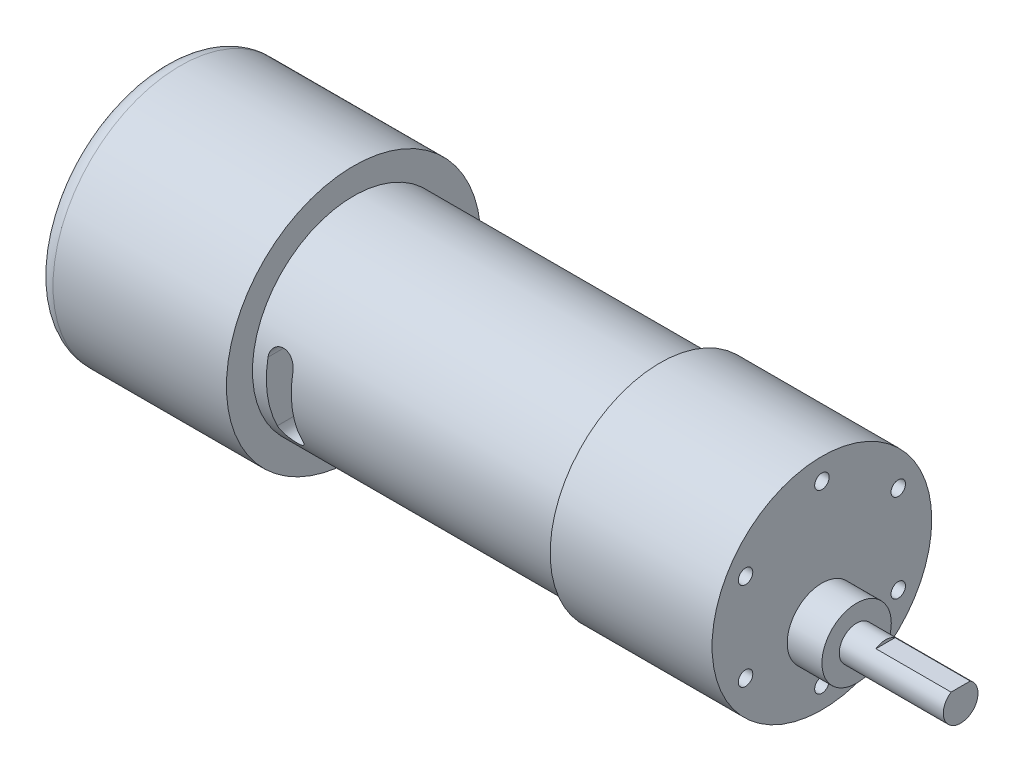
from build123d import *

# Parameters (mm, degrees)
SKETCH1_R           = 22
BOSS_EXTRUDE1_DEPTH = 33
SKETCH2_R           = 17.5
BOSS_EXTRUDE2_DEPTH = 53
SKETCH4_R           = 19
BOSS_EXTRUDE3_DEPTH = 28
CUT_EXTRUDE1_DEPTH  = 119.169369974
SKETCH13_R          = 1.25
CUT_EXTRUDE2_DEPTH  = 3.5
SKETCH15_R          = 6
BOSS_EXTRUDE4_DEPTH = 6
SKETCH16_R          = 3
BOSS_EXTRUDE5_DEPTH = 24
CUT_EXTRUDE3_DEPTH  = 13
FILLET1_R           = 3
SKETCH18_R          = 1
BOSS_EXTRUDE6_DEPTH = 5


with BuildPart() as part:
    # Sketch1 → Boss-Extrude1 (new body)
    with BuildSketch(Plane(origin=(0, 0, 0), x_dir=(0, 0, -1), z_dir=(1, 0, 0))):
        Circle(SKETCH1_R)
    extrude(amount=BOSS_EXTRUDE1_DEPTH)

    # Sketch2 → Boss-Extrude2 (add)
    with BuildSketch(Plane(origin=(33, 0, 0), x_dir=(0, 0, -1), z_dir=(1, 0, 0))):
        Circle(SKETCH2_R)
    extrude(amount=BOSS_EXTRUDE2_DEPTH)

    # Sketch4 → Boss-Extrude3 (add)
    with BuildSketch(Plane(origin=(86, 0, 0), x_dir=(0, 0, -1), z_dir=(1, 0, 0))):
        Circle(SKETCH4_R)
    extrude(amount=BOSS_EXTRUDE3_DEPTH)

    # Sketch12 → Cut-Extrude1 (cut, through all)
    with BuildSketch(Plane.XY):
        with BuildLine():
            Line((39.717889668, 3.156796221), (39.717889668, -7.930488068))
            ThreePointArc((39.717889668, -7.930488068), (37.562028834, -10.086348902), (35.406168, -7.930488068))
            Line((35.406168, -7.930488068), (35.406168, 3.156796221))
            ThreePointArc((35.406168, 3.156796221), (37.562028834, 5.312657055), (39.717889668, 3.156796221))
        make_face()
    extrude(amount=CUT_EXTRUDE1_DEPTH, mode=Mode.SUBTRACT)

    # Sketch13 → Cut-Extrude2 (cut)
    with BuildSketch(Plane(origin=(114, 0, 0), x_dir=(0, 0, -1), z_dir=(1, 0, 0))):
        with Locations((0, 15.25)):
            Circle(SKETCH13_R)
        with Locations((13.206887408, 7.625)):
            Circle(SKETCH13_R)
        with Locations((13.206887408, -7.625)):
            Circle(SKETCH13_R)
        with Locations((0, -15.25)):
            Circle(SKETCH13_R)
        with Locations((-13.206887408, -7.625)):
            Circle(SKETCH13_R)
        with Locations((-13.206887408, 7.625)):
            Circle(SKETCH13_R)
    extrude(amount=-CUT_EXTRUDE2_DEPTH, mode=Mode.SUBTRACT)

    # Sketch15 → Boss-Extrude4 (add)
    with BuildSketch(Plane(origin=(114, 0, 0), x_dir=(0, 0, -1), z_dir=(1, 0, 0))):
        with Locations((0, -6)):
            Circle(SKETCH15_R)
    extrude(amount=BOSS_EXTRUDE4_DEPTH)

    # Sketch16 → Boss-Extrude5 (add)
    with BuildSketch(Plane(origin=(114, 0, 0), x_dir=(0, 0, -1), z_dir=(1, 0, 0))):
        with Locations((0, -6)):
            Circle(SKETCH16_R)
    extrude(amount=BOSS_EXTRUDE5_DEPTH)

    # Sketch17 → Cut-Extrude3 (cut)
    with BuildSketch(Plane(origin=(138, 0, 0), x_dir=(0, 0, -1), z_dir=(1, 0, 0))):
        Polygon((1.658312395, -3.5), (3, -3.5), (3, -1.535610447), (1.658312395, -1.535610447), (-2.178415849, -1.535610447), (-2.178415849, -3.5), align=None)
    extrude(amount=-CUT_EXTRUDE3_DEPTH, mode=Mode.SUBTRACT)

    # Fillet1
    fillet1_edges = [part.edges().sort_by_distance(p)[0] for p in [
        (0, 0, 22),
    ]]
    fillet(fillet1_edges, radius=FILLET1_R)

    # Sketch18 → Boss-Extrude6 (add)
    with BuildSketch(Plane.ZY):
        Circle(SKETCH18_R)
    extrude(amount=BOSS_EXTRUDE6_DEPTH)


solid = part.part
